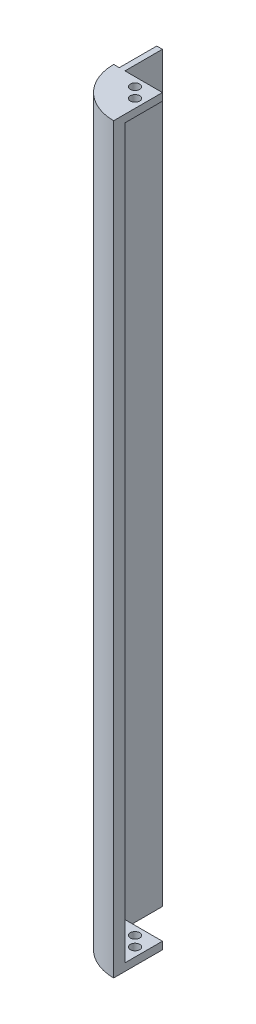
from build123d import *

# Parameters (mm, degrees)
SKETCH_1_W                  = 30
SKETCH_1_H                  = 11
EXTRUDE_1_DEPTH             = 6
SKETCH_2_W                  = 16
SKETCH_2_H                  = 2
CUT_EXTRUDE_1_DEPTH         = 144
EXTRUDE_2_DEPTH             = 192
SKETCH_4_R                  = 1.75
CUT_EXTRUDE_2_DEPTH         = 144
SKETCH_5_W                  = 11
SKETCH_5_H                  = 198
CUT_EXTRUDE_3_DEPTH         = 2.5
EXTRUDE_3_REACH             = 194.664
EXTRUDE_3_DIRECTION_2_REACH = 194.664
SKETCH_7_W                  = 1.5
SKETCH_7_H                  = 198
EXTRUDE_4_DEPTH             = 10
CUT_EXTRUDE_4_DEPTH         = 40
EXTRUDE_5_DEPTH             = 2
SKETCH_10_R                 = 1.25
CUT_EXTRUDE_5_DEPTH         = 3


with BuildPart() as part:
    # 草图1 → 凸台-拉伸1 (new body)
    with BuildSketch(Plane(origin=(0, 0, 0), x_dir=(1, 0, 0), z_dir=(0, 1, 0))):
        Rectangle(SKETCH_1_W, SKETCH_1_H)
    extrude(amount=EXTRUDE_1_DEPTH)

    # 草图2 → 切除-拉伸1 (cut)
    with BuildSketch(Plane.ZY.offset(15)):
        with Locations((-5.5, 3)):
            Rectangle(SKETCH_2_W, SKETCH_2_H)
    extrude(amount=-CUT_EXTRUDE_1_DEPTH, mode=Mode.SUBTRACT)

    # 草图3 → 凸台-拉伸2 (add)
    with BuildSketch(Plane(origin=(0, 6, 0), x_dir=(1, 0, 0), z_dir=(0, 1, 0))):
        Polygon((2, 5.5), (-2, 5.5), (-2, -3.5), (-15, -3.5), (-15, -5.5), (15, -5.5), (15, -3.5), (2, -3.5), align=None)
    extrude(amount=EXTRUDE_2_DEPTH)

    # 草图4 → 切除-拉伸2 (cut)
    with BuildSketch(Plane(origin=(0, 6, 0), x_dir=(1, 0, 0), z_dir=(0, 1, 0))):
        with Locations(Location((-7.5, 2, 0), (0, 0, 270))):
            Circle(SKETCH_4_R)
        with Locations(Location((7.5, 2, 0), (0, 0, 270))):
            Circle(SKETCH_4_R)
    extrude(amount=-CUT_EXTRUDE_2_DEPTH, mode=Mode.SUBTRACT)

    # 草图5 → 切除-拉伸3 (cut)
    with BuildSketch(Plane.ZY.offset(15)):
        with Locations((0, 99)):
            Rectangle(SKETCH_5_W, SKETCH_5_H)
    extrude(amount=-CUT_EXTRUDE_3_DEPTH, mode=Mode.SUBTRACT)

    # 凸台-拉伸3: up to this face of the body (flat: up to its plane)
    extrude_3_end = Plane(part.part.faces().sort_by_distance((0.755494505, 198, 2.324175824))[0])
    # 草图6 → 凸台-拉伸3 (add, up to the picked face)
    with BuildSketch(Plane(origin=(0, 6, 0), x_dir=(1, 0, 0), z_dir=(0, 1, 0)), mode=Mode.PRIVATE) as extrude_3_sk1:
        with BuildLine():
            Line((-22.5, 7.5), (-25.5, 7.5))
            ThreePointArc((-25.5, 7.5), (-21.692388155, -1.692388155), (-12.5, -5.5))
            Line((-12.5, -5.5), (-12.5, -2.5))
            ThreePointArc((-12.5, -2.5), (-19.571067812, 0.428932188), (-22.5, 7.5))
        make_face()
    extrude_3_tool1 = split(extrude(extrude_3_sk1.sketch, amount=EXTRUDE_3_REACH, mode=Mode.PRIVATE), bisect_by=extrude_3_end, keep=Keep.BOTH, mode=Mode.PRIVATE)
    add(extrude_3_tool1.solids().sort_by(Axis((-19.862646, 6, -0.137354), (0, 1, 0)))[0])

    # 凸台-拉伸3 direction 2: up to this face of the body (flat: up to its plane)
    extrude_3_direction_2_end = Plane(part.part.faces().sort_by_distance((1.334914955, 0, 0.135863928))[0])
    # 草图6 → 凸台-拉伸3 direction 2 (add, up to the picked face)
    with BuildSketch(Plane(origin=(0, 6, 0), x_dir=(1, 0, 0), z_dir=(0, 1, 0)), mode=Mode.PRIVATE) as extrude_3_direction_2_sk1:
        with BuildLine():
            Line((-22.5, 7.5), (-25.5, 7.5))
            ThreePointArc((-25.5, 7.5), (-21.692388155, -1.692388155), (-12.5, -5.5))
            Line((-12.5, -5.5), (-12.5, -2.5))
            ThreePointArc((-12.5, -2.5), (-19.571067812, 0.428932188), (-22.5, 7.5))
        make_face()
    extrude_3_direction_2_tool1 = split(extrude(extrude_3_direction_2_sk1.sketch, amount=-EXTRUDE_3_DIRECTION_2_REACH, mode=Mode.PRIVATE), bisect_by=extrude_3_direction_2_end, keep=Keep.BOTH, mode=Mode.PRIVATE)
    add(extrude_3_direction_2_tool1.solids().sort_by(Axis((-19.862646, 6, -0.137354), (0, -1, 0)))[0])

    # 草图7 → 凸台-拉伸4 (add)
    with BuildSketch(Plane(origin=(0, 0, -7.5), x_dir=(-1, 0, 0), z_dir=(0, 0, -1))):
        with Locations((23.25, 99)):
            Rectangle(SKETCH_7_W, SKETCH_7_H)
    extrude(amount=EXTRUDE_4_DEPTH)

    # 草图8 → 切除-拉伸4 (cut)
    with BuildSketch(Plane(origin=(-12.5, 0, 0), x_dir=(0, 0, -1), z_dir=(1, 0, 0))):
        Polygon((26.892505746, 198), (-2.5, 198), (-2.5, 6), (-2.5, -9.514717226), (26.892505746, -9.514717226), align=None)
        Polygon((-3.5, 6), (-3.5, 198), (-26.700940199, 198), (-26.700940199, -9.514717226), (-2.5, -9.514717226), (-2.5, 6), align=None)
    extrude(amount=CUT_EXTRUDE_4_DEPTH, mode=Mode.SUBTRACT)


with BuildPart() as cut_extrude_4_kept_piece:
    # of the separate pieces the step leaves, the one the design keeps (cut_extrude_4_pieces_kept)
    add(part.part.solids().sort_by_distance((-22.5, 0, -7.5))[0])

    # 草图9 → 凸台-拉伸5 (add)
    with BuildSketch(Plane(origin=(0, 198, 0), x_dir=(1, 0, 0), z_dir=(0, 1, 0))):
        with BuildLine():
            Line((-12.5, -2.5), (-12.5, 7.5))
            Line((-12.5, 7.5), (-22.5, 7.5))
            ThreePointArc((-22.5, 7.5), (-19.571067812, 0.428932188), (-12.5, -2.5))
        make_face()
    extrude_5 = extrude(amount=-EXTRUDE_5_DEPTH)

    # 草图10 → 切除-拉伸5 (cut)
    with BuildSketch(Plane(origin=(0, 196, 0), x_dir=(-1, 0, 0), z_dir=(0, -1, 0))):
        with Locations(Location((14.8, 2.5, 0), (0, 0, 90))):
            Circle(SKETCH_10_R)
        with Locations(Location((17.5, 5.2, 0), (0, 0, 90))):
            Circle(SKETCH_10_R)
    cut_extrude_5 = extrude(amount=-CUT_EXTRUDE_5_DEPTH, mode=Mode.SUBTRACT)

    # 镜向2: 凸台-拉伸5, 切除-拉伸5 across plane
    add(extrude_5.mirror(Plane(origin=(0, 99, 0), x_dir=(0, 0, 1), z_dir=(0, -1, 0))))
    add(cut_extrude_5.mirror(Plane(origin=(0, 99, 0), x_dir=(0, 0, 1), z_dir=(0, -1, 0))), mode=Mode.SUBTRACT)


solid = cut_extrude_4_kept_piece.part
